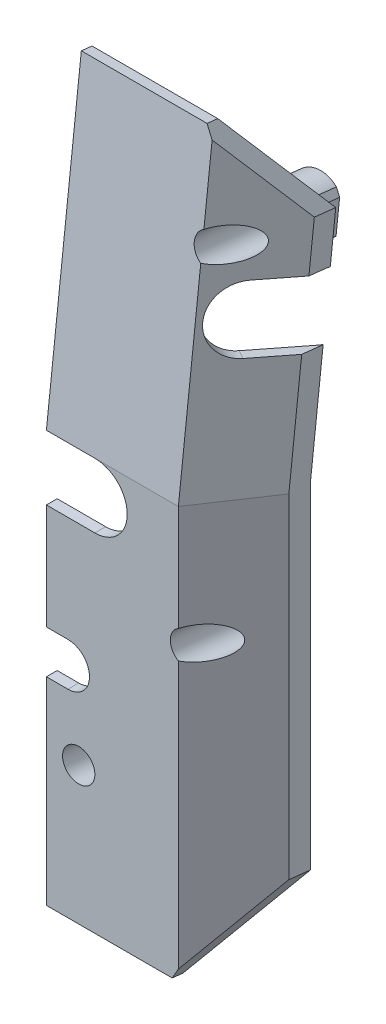
from build123d import *

# Parameters (mm, degrees)
SKETCH1_W           = 23.339745962
SKETCH1_H           = 77.847771952
EXTRUDE1_DEPTH      = 2
SKETCH2_W           = 23.339745962
SKETCH2_H           = 58.47295833
EXTRUDE2_DEPTH      = 2
EXTRUDE3_DEPTH      = 2
EXTRUDE4_DEPTH      = 2
SKETCH5_W           = 29.172294857
SKETCH5_H           = 114.252589879
CUT_EXTRUDE1_DEPTH  = 2
SKETCH6_W           = 35.17541313
SKETCH6_H           = 36.355570025
CUT_EXTRUDE3_DEPTH  = 9
SKETCH7_W           = 29.640366785
SKETCH7_H           = 86.495658127
CUT_EXTRUDE4_DEPTH  = 9
SKETCH8_W           = 29.536232552
SKETCH8_H           = 67.327773858
CUT_EXTRUDE5_DEPTH  = 9
SKETCH9_W           = 23.303500438
SKETCH9_H           = 17.745035166
CUT_EXTRUDE6_DEPTH  = 9
SKETCH10_W          = 29.605950058
SKETCH10_H          = 24.209977647
CUT_EXTRUDE7_DEPTH  = 9
SKETCH11_W          = 17.28028661
SKETCH11_H          = 57.043927735
CUT_EXTRUDE8_DEPTH  = 9
SKETCH12_W          = 46.644962208
SKETCH12_H          = 26.527348651
CUT_EXTRUDE9_DEPTH  = 9
SKETCH13_W          = 27.90261226
SKETCH13_H          = 36.830907155
CUT_EXTRUDE10_DEPTH = 9
CUT_EXTRUDE11_DEPTH = 9
CUT_EXTRUDE12_DEPTH = 9
EXTRUDE5_REACH      = 108.706
SKETCH16_R          = 1.6
SKETCH18_R          = 3
CUT_EXTRUDE13_DEPTH = 16
CUT_EXTRUDE14_DEPTH = 46


with BuildPart() as part:
    # Sketch1 → Extrude1 (new body)
    with BuildSketch(Plane.XY):
        with Locations((11.669872981, -62.635077412)):
            Rectangle(SKETCH1_W, SKETCH1_H)
    extrude(amount=EXTRUDE1_DEPTH)

    # Sketch2 → Extrude2 (add)
    with BuildSketch(Plane(origin=(0, -0.312184271, -2.780754984), x_dir=(1, 0, 0), z_dir=(-1.8145207558717603e-15, 0.11156514837203096, 0.9937571220719512))):
        with Locations((11.669872981, 3.838577658)):
            Rectangle(SKETCH2_W, SKETCH2_H)
    extrude(amount=EXTRUDE2_DEPTH)

    # Sketch3 → Extrude3 (add)
    with BuildSketch(Plane(origin=(17.504809472, 0, 10.106406461), x_dir=(0.49999999999999906, -1.634548474587185e-15, -0.8660254037844393), z_dir=(0.8660254037844392, -2.831121005419217e-15, 0.499999999999999))):
        Polygon((7.883442522, -104.490571733), (28.990381057, -88.148722114), (28.990381057, -25.920882689), (7.883442522, -23.352575413), align=None)
    extrude(amount=EXTRUDE3_DEPTH)

    # Sketch4 → Extrude4 (add)
    with BuildSketch(Plane(origin=(16.293142957, 1.049476669, 9.348124653), x_dir=(0.49585100083824124, 0.031938838189501655, -0.8678200824956861), z_dir=(0.8660254037844394, 0.055782574186015135, 0.49687856103597455))):
        Polygon((16.15670827, 37.302716602), (33.476734925, 13.886588158), (28.056650386, -27.924204291), (7.502507009, -29.456207578), align=None)
    extrude(amount=EXTRUDE4_DEPTH)

    # Sketch5 → Cut-Extrude1 (cut)
    with BuildSketch(Plane(origin=(32, 0, 0), x_dir=(0, 0, -1), z_dir=(1, 0, 0))):
        with Locations((10.907999104, -37.350448714)):
            Rectangle(SKETCH5_W, SKETCH5_H)
    extrude(amount=CUT_EXTRUDE1_DEPTH, mode=Mode.SUBTRACT)

    # Sketch6 → Cut-Extrude3 (cut)
    with BuildSketch(Plane(origin=(0, -100.294881076, 11.25970626), x_dir=(1, 0, 0), z_dir=(0, -0.9937571220719427, 0.11156514837210559))):
        with Locations((14.876045987, -2.775102741)):
            Rectangle(SKETCH6_W, SKETCH6_H)
    extrude(amount=CUT_EXTRUDE3_DEPTH, mode=Mode.SUBTRACT)

    # Sketch7 → Cut-Extrude4 (cut)
    with BuildSketch(Plane.XY.offset(2)):
        with Locations((12.797447922, -61.090112125)):
            Rectangle(SKETCH7_W, SKETCH7_H)
    extrude(amount=CUT_EXTRUDE4_DEPTH, mode=Mode.SUBTRACT)

    # Sketch8 → Cut-Extrude5 (cut)
    with BuildSketch(Plane(origin=(0, -0.089053974, -0.79324074), x_dir=(1, 0, 0), z_dir=(-1.815565503199705e-15, 0.11156514837203098, 0.9937571220719512))):
        with Locations((12.836169201, 6.237775634)):
            Rectangle(SKETCH8_W, SKETCH8_H)
    extrude(amount=CUT_EXTRUDE5_DEPTH, mode=Mode.SUBTRACT)

    # Sketch9 → Cut-Extrude6 (cut)
    with BuildSketch(Plane(origin=(19.236860279, 0, 11.106406461), x_dir=(0.499999999999999, -1.6472663592524059e-15, -0.8660254037844393), z_dir=(0.8660254037844393, -2.8531490278241828e-15, 0.499999999999999))):
        with Locations((15.539372555, -25.628375436)):
            Rectangle(SKETCH9_W, SKETCH9_H)
    extrude(amount=CUT_EXTRUDE6_DEPTH, mode=Mode.SUBTRACT)

    # Sketch10 → Cut-Extrude7 (cut)
    with BuildSketch(Plane(origin=(18.025193764, 1.161041817, 10.341881775), x_dir=(0.49585100083824124, 0.03193883818950166, -0.8678200824956862), z_dir=(0.8660254037844393, 0.05578257418601514, 0.49687856103597444))):
        with Locations((15.868735202, -22.435122808)):
            Rectangle(SKETCH10_W, SKETCH10_H)
    extrude(amount=CUT_EXTRUDE7_DEPTH, mode=Mode.SUBTRACT)

    # Sketch11 → Cut-Extrude8 (cut)
    with BuildSketch(Plane(origin=(0, 32.868573281, -3.690023622), x_dir=(1, 0, 0), z_dir=(0, 0.9937571220719428, -0.11156514837210517))):
        with Locations((25.498335125, 2.54094703)):
            Rectangle(SKETCH11_W, SKETCH11_H)
    extrude(amount=CUT_EXTRUDE8_DEPTH, mode=Mode.SUBTRACT)

    # Sketch12 → Cut-Extrude9 (cut)
    with BuildSketch(Plane(origin=(31.826729192, 18.260456719, -2.050028642), x_dir=(-0.048384463847340485, -0.027760389785225534, -0.9984429399906526), z_dir=(0.8660254037844403, 0.496878561035969, -0.055782574186050725))):
        with Locations((12.073297204, 7.763321363)):
            Rectangle(SKETCH12_W, SKETCH12_H)
    extrude(amount=CUT_EXTRUDE9_DEPTH, mode=Mode.SUBTRACT)

    # Sketch13 → Cut-Extrude10 (cut)
    with BuildSketch(Plane(origin=(61.206591805, -35.117033668, 3.942449301), x_dir=(0.048384463847343365, -0.027760389785227164, -0.9984429399906524), z_dir=(0.8660254037844402, -0.49687856103596856, 0.055782574186054035))):
        with Locations((11.882531158, -68.145692396)):
            Rectangle(SKETCH13_W, SKETCH13_H)
    extrude(amount=CUT_EXTRUDE10_DEPTH, mode=Mode.SUBTRACT)

    # Sketch14 → Cut-Extrude11 (cut)
    with BuildSketch(Plane.XY.offset(2)):
        with BuildLine():
            Line((-5.730960927, -24.969609587), (9, -24.969609587))
            ThreePointArc((9, -24.969609587), (15, -30.969609587), (9, -36.969609587))
            Line((9, -36.969609587), (-5.730960927, -36.969609587))
            ThreePointArc((-5.730960927, -36.969609587), (-11.730960927, -30.969609587), (-5.730960927, -24.969609587))
        make_face()
    extrude(amount=-CUT_EXTRUDE11_DEPTH, mode=Mode.SUBTRACT)

    # Sketch15 → Cut-Extrude12 (cut)
    with BuildSketch(Plane(origin=(18.025193764, 1.161041817, 10.341881775), x_dir=(0.49585100083824163, 0.03193883818950172, -0.8678200824956859), z_dir=(0.866025403784439, 0.055782574186015205, 0.49687856103597494))):
        with BuildLine():
            Line((20.949277707, 6.423782658), (31.529743864, 5.052198489))
            ThreePointArc((31.529743864, 5.052198489), (36.708608329, -1.669361066), (29.987048774, -6.848225531))
            Line((29.987048774, -6.848225531), (19.406582616, -5.476641362))
            ThreePointArc((19.406582616, -5.476641362), (14.227718152, 1.244918193), (20.949277707, 6.423782658))
        make_face()
    extrude(amount=-CUT_EXTRUDE12_DEPTH, mode=Mode.SUBTRACT)

    # Sketch16 → Extrude5 (add, up to next)
    with BuildSketch(Plane(origin=(0, -2.320356941, -20.668383181), x_dir=(1, 0, 0), z_dir=(-1.8077100882975075e-15, 0.111565148372031, 0.9937571220719512)), mode=Mode.PRIVATE) as extrude5_sk1:
        with BuildLine():
            Line((29.8, 11.55156303), (29.8, 17.4855686))
            Line((29.8, 17.4855686), (29.072366829, 18.745866221))
            ThreePointArc((29.072366829, 18.745866221), (21.025378802, 14.298044274), (29.8, 11.55156303))
        make_face()
        with Locations((26, 14.801178392)):
            Circle(SKETCH16_R, mode=Mode.SUBTRACT)
    extrude5_tool1 = extrude(extrude5_sk1.sketch, amount=EXTRUDE5_REACH, mode=Mode.PRIVATE) - part.part
    # Sketch16 → Extrude5 (add, up to next)
    with BuildSketch(Plane(origin=(0, -2.320356941, -20.668383181), x_dir=(1, 0, 0), z_dir=(-1.8077100882975075e-15, 0.111565148372031, 0.9937571220719512)), mode=Mode.PRIVATE) as extrude5_sk2:
        with BuildLine():
            ThreePointArc((2.2, -78.798690089), (11, -75.549074727), (2.2, -72.299459365))
            Line((2.2, -72.299459365), (2.2, -78.798690089))
        make_face()
        with Locations((6, -75.549074727)):
            Circle(SKETCH16_R, mode=Mode.SUBTRACT)
    extrude5_tool2 = extrude(extrude5_sk2.sketch, amount=EXTRUDE5_REACH, mode=Mode.PRIVATE) - part.part
    # Sketch16 → Extrude5 (add, up to next)
    with BuildSketch(Plane(origin=(0, -2.320356941, -20.668383181), x_dir=(1, 0, 0), z_dir=(-1.8077100882975075e-15, 0.111565148372031, 0.9937571220719512)), mode=Mode.PRIVATE) as extrude5_sk3:
        with BuildLine():
            Line((29.8, -50.366348697), (29.8, -43.867117974))
            ThreePointArc((29.8, -43.867117974), (21, -47.116733335), (29.8, -50.366348697))
        make_face()
        with Locations((26, -47.116733335)):
            Circle(SKETCH16_R, mode=Mode.SUBTRACT)
    extrude5_tool3 = extrude(extrude5_sk3.sketch, amount=EXTRUDE5_REACH, mode=Mode.PRIVATE) - part.part
    add(extrude5_tool1.solids().sort_by_distance((21.157909, 11.901747, -22.265042))[0])
    add(extrude5_tool2.solids().sort_by_distance((10.866793, -77.397788, -12.239739))[0])
    add(extrude5_tool3.solids().sort_by_distance((29.666793, -49.142946, -15.411798))[0])

    # Sketch18 → Cut-Extrude13 (cut)
    with BuildSketch(Plane(origin=(0, -0.089053974, -0.79324074), x_dir=(1, 0, 0), z_dir=(-1.8077100882975075e-15, 0.111565148372031, 0.9937571220719512))):
        with Locations((26, 14.801178392)):
            Circle(SKETCH18_R)
        with Locations((26, -47.116733335)):
            Circle(SKETCH18_R)
        with Locations((6, -75.549074727)):
            Circle(SKETCH18_R)
    extrude(amount=-CUT_EXTRUDE13_DEPTH, mode=Mode.SUBTRACT)

    # Sketch19 → Cut-Extrude14 (cut)
    with BuildSketch(Plane.XY.offset(2)):
        with BuildLine():
            Line((-9.54644603, -56.58750618), (4, -56.58750618))
            ThreePointArc((4, -56.58750618), (8, -60.58750618), (4, -64.58750618))
            Line((4, -64.58750618), (-9.54644603, -64.58750618))
            ThreePointArc((-9.54644603, -64.58750618), (-13.54644603, -60.58750618), (-9.54644603, -56.58750618))
        make_face()
    extrude(amount=-CUT_EXTRUDE14_DEPTH, mode=Mode.SUBTRACT)


solid = part.part
